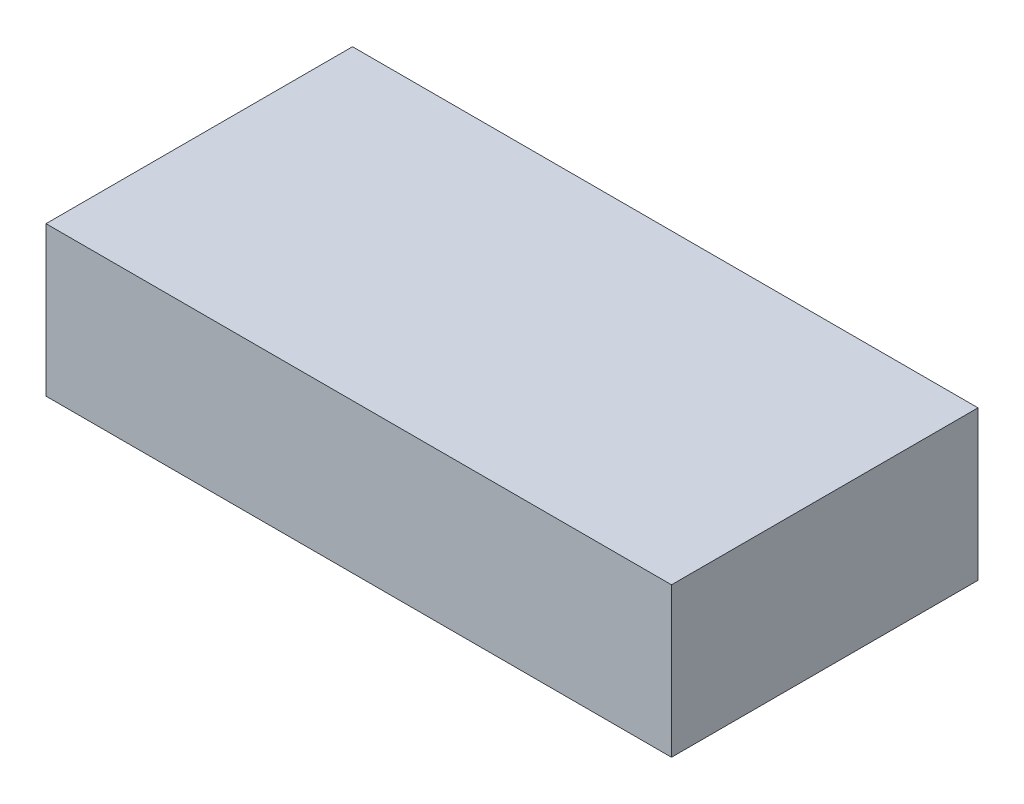
from build123d import *

# Parameters (mm, degrees)
SKETCH1_W                 = 76.2
SKETCH1_H                 = 50.8
BOSS_EXTRUDE1_DEPTH       = 1.6
SKETCH2_W                 = 73.14
SKETCH2_H                 = 35.84
BOSS_EXTRUDE2_DEPTH       = 17.47
SKETCH3_W                 = 76.2
SKETCH3_H                 = 50.8
HEAT_SINK_SHAVE_MOD_DEPTH = 1.6


with BuildPart() as part:
    # Sketch1 → Boss-Extrude1 (new body)
    with BuildSketch(Plane(origin=(0, 0, 0), x_dir=(1, 0, 0), z_dir=(0, 1, 0))):
        Rectangle(SKETCH1_W, SKETCH1_H)
    extrude(amount=BOSS_EXTRUDE1_DEPTH)

    # Sketch2 → Boss-Extrude2 (add)
    with BuildSketch(Plane(origin=(0, 1.6, 0), x_dir=(1, 0, 0), z_dir=(0, 1, 0))):
        Rectangle(SKETCH2_W, SKETCH2_H)
    extrude(amount=BOSS_EXTRUDE2_DEPTH)

    # Sketch3 → Heat Sink Shave Mod (cut)
    with BuildSketch(Plane.XZ):
        Rectangle(SKETCH3_W, SKETCH3_H)
    extrude(amount=-HEAT_SINK_SHAVE_MOD_DEPTH, mode=Mode.SUBTRACT)


solid = part.part
